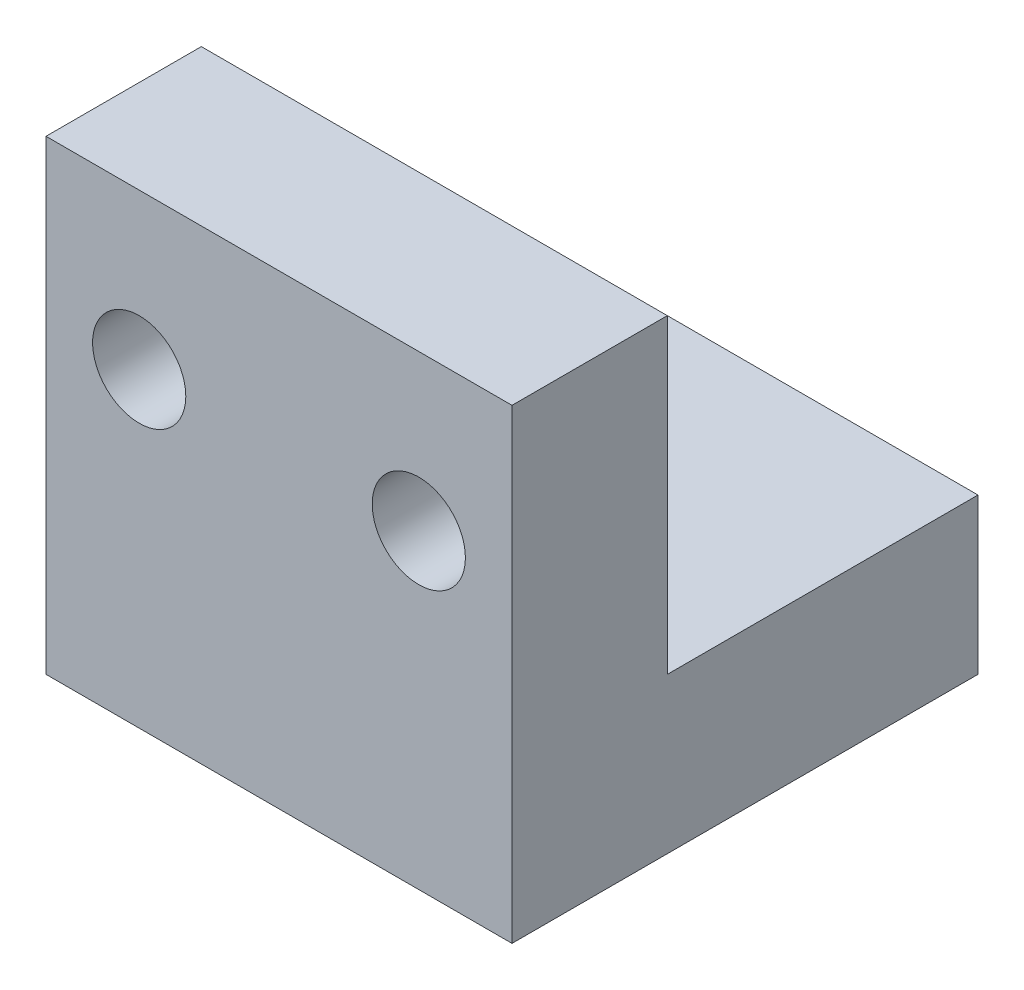
from build123d import *

# Parameters (mm, degrees)
SKETCH_1_W      = 15
SKETCH_1_H      = 15
SKETCH_1_R      = 1.5
EXTRUDE_1_DEPTH = 5
SKETCH_2_W      = 15
SKETCH_2_H      = 15
SKETCH_2_R      = 1.5
EXTRUDE_2_DEPTH = 5


with BuildPart() as part:
    # 草图1 → 凸台-拉伸1 (new body)
    with BuildSketch(Plane(origin=(0, 0, 0), x_dir=(1, 0, 0), z_dir=(0, 1, 0))):
        with Locations((7.5, 7.5)):
            Rectangle(SKETCH_1_W, SKETCH_1_H)
        with Locations(Location((7.5, 10, 0), (0, 0, 270))):
            Circle(SKETCH_1_R, mode=Mode.SUBTRACT)
    extrude(amount=EXTRUDE_1_DEPTH)

    # 草图2 → 凸台-拉伸2 (add)
    with BuildSketch(Plane.XY):
        with Locations((7.5, 7.5)):
            Rectangle(SKETCH_2_W, SKETCH_2_H)
        with Locations((3, 10)):
            Circle(SKETCH_2_R, mode=Mode.SUBTRACT)
        with Locations((12, 10)):
            Circle(SKETCH_2_R, mode=Mode.SUBTRACT)
    extrude(amount=-EXTRUDE_2_DEPTH)


solid = part.part
